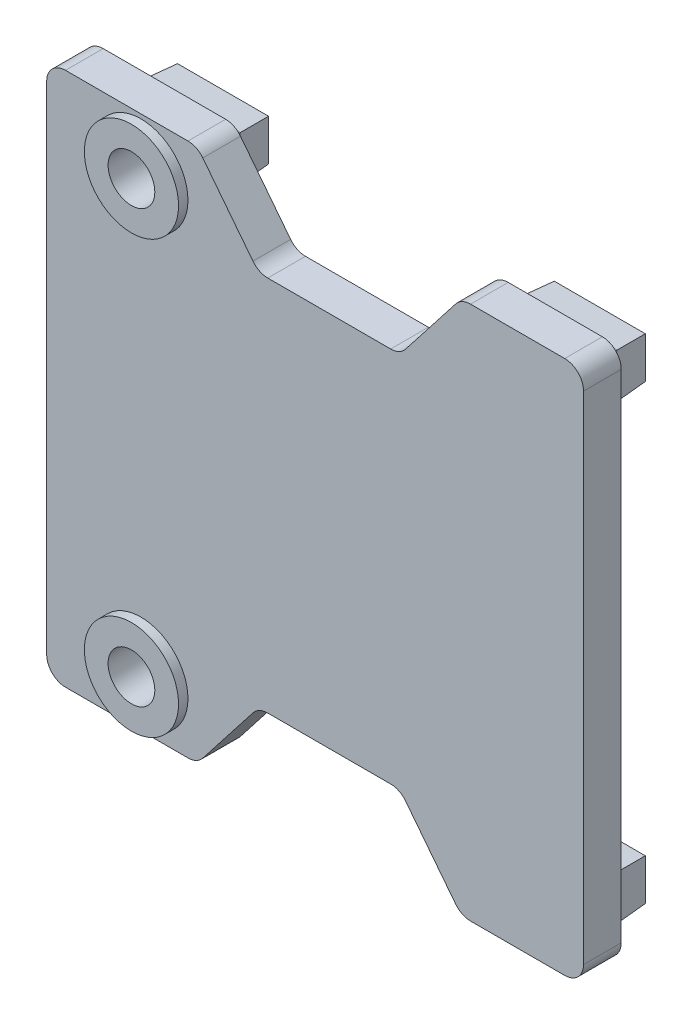
from build123d import *

# Parameters (mm, degrees)
SKETCH1_R                     = 1.575
BOSS_EXTRUDE1_DEPTH           = 2.54
SKETCH2_R                     = 3.175
SKETCH2_R_2                   = 1.575
BOSS_EXTRUDE2_DEPTH           = 0.635
SKETCH3_W                     = 6.35
SKETCH3_H                     = 3
BOSS_EXTRUDE3_DEPTH           = 1
SKETCH4_W                     = 6.35
SKETCH4_H                     = 3
BOSS_EXTRUDE4_DEPTH           = 2
BOSS_EXTRUDE4_DRAFT           = 3
BOSS_EXTRUDE4_PROFILE_2_DEPTH = 2
BOSS_EXTRUDE4_PROFILE_2_DRAFT = 3


with BuildPart() as part:
    # Sketch1 → Boss-Extrude1 (new body)
    with BuildSketch(Plane.XY):
        with BuildLine():
            Line((-184.15, 18.01), (-180.975, 18.01))
            ThreePointArc((-180.975, 18.01), (-180.417860718, 17.88126939), (-179.973667703, 17.521174521))
            Line((-179.973667703, 17.521174521), (-176.593849938, 13.188825479))
            ThreePointArc((-176.593849938, 13.188825479), (-176.149656923, 12.82873061), (-175.592517642, 12.7))
            Line((-175.592517642, 12.7), (-167.307482358, 12.7))
            ThreePointArc((-167.307482358, 12.7), (-166.750343077, 12.82873061), (-166.306150062, 13.188825479))
            Line((-166.306150062, 13.188825479), (-162.926332297, 17.521174521))
            ThreePointArc((-162.926332297, 17.521174521), (-162.482139282, 17.88126939), (-161.925, 18.01))
            Line((-161.925, 18.01), (-155.575, 18.01))
            ThreePointArc((-155.575, 18.01), (-154.676974388, 17.638025612), (-154.305, 16.74))
            Line((-154.305, 16.74), (-154.305, 0))
            Line((-154.305, 0), (-190.5, 0))
            Line((-190.5, 0), (-190.5, 16.74))
            ThreePointArc((-190.5, 16.74), (-190.128025612, 17.638025612), (-189.23, 18.01))
            Line((-189.23, 18.01), (-184.15, 18.01))
        make_face()
        with Locations((-184.15, 14.54645)):
            Circle(SKETCH1_R, mode=Mode.SUBTRACT)
    extrude(amount=BOSS_EXTRUDE1_DEPTH)

    # Sketch2 → Boss-Extrude2 (add)
    with BuildSketch(Plane.XY.offset(2.54)):
        with Locations((-184.15, 14.54645)):
            Circle(SKETCH2_R)
        with Locations((-184.15, 14.54645)):
            Circle(SKETCH2_R_2, mode=Mode.SUBTRACT)
    extrude(amount=BOSS_EXTRUDE2_DEPTH)

    # Sketch3 → Boss-Extrude3 (add)
    with BuildSketch(Plane(origin=(0, 0, 0), x_dir=(-1, 0, 0), z_dir=(0, 0, -1))):
        with Locations((184.15, 15.24)):
            Rectangle(SKETCH3_W, SKETCH3_H)
        with Locations((158.75, 15.24)):
            Rectangle(SKETCH3_W, SKETCH3_H)
    extrude(amount=BOSS_EXTRUDE3_DEPTH)


with BuildPart() as boss_extrude4_tool:
    # Sketch4 → Boss-Extrude4 (with draft: the straight prism first)
    with BuildSketch(Plane(origin=(0, 0, -1), x_dir=(-1, 0, 0), z_dir=(0, 0, -1))):
        with Locations((184.15, 15.24)):
            Rectangle(SKETCH4_W, SKETCH4_H)
    extrude(amount=BOSS_EXTRUDE4_DEPTH)
    # Boss-Extrude4: the draft: its side faces are tilted about the plane it starts from
    boss_extrude4_sides = [boss_extrude4_tool.faces().sort_by_distance(p)[0] for p in [
        (-180.975, 15.24, -2),
        (-184.15, 13.74, -2),
        (-187.325, 15.24, -2),
        (-184.15, 16.74, -2),
    ]]
    draft(boss_extrude4_sides, Plane(origin=(0, 0, -1), x_dir=(-1, 0, 0), z_dir=(0, 0, -1)), BOSS_EXTRUDE4_DRAFT)


with BuildPart() as part_1:
    add(part.part)

    # Boss-Extrude4: add boss_extrude4_tool
    add(boss_extrude4_tool.part)


with BuildPart() as boss_extrude4_profile_2_tool:
    # Sketch4 → Boss-Extrude4 profile 2 (with draft: the straight prism first)
    with BuildSketch(Plane(origin=(0, 0, -1), x_dir=(-1, 0, 0), z_dir=(0, 0, -1))):
        with Locations((158.75, 15.24)):
            Rectangle(SKETCH4_W, SKETCH4_H)
    extrude(amount=BOSS_EXTRUDE4_PROFILE_2_DEPTH)
    # Boss-Extrude4 profile 2: the draft: its side faces are tilted about the plane it starts from
    boss_extrude4_profile_2_sides = [boss_extrude4_profile_2_tool.faces().sort_by_distance(p)[0] for p in [
        (-155.575, 15.24, -2),
        (-158.75, 13.74, -2),
        (-161.925, 15.24, -2),
        (-158.75, 16.74, -2),
    ]]
    draft(boss_extrude4_profile_2_sides, Plane(origin=(0, 0, -1), x_dir=(-1, 0, 0), z_dir=(0, 0, -1)), BOSS_EXTRUDE4_PROFILE_2_DRAFT)


with BuildPart() as part_2:
    add(part_1.part)

    # Boss-Extrude4 profile 2: add boss_extrude4_profile_2_tool
    add(boss_extrude4_profile_2_tool.part)

    # Mirror1: part across plane


with BuildPart() as part_3:
    add(part_2.part)
    add(part_2.part.mirror(Plane.ZX))


solid = part_3.part
